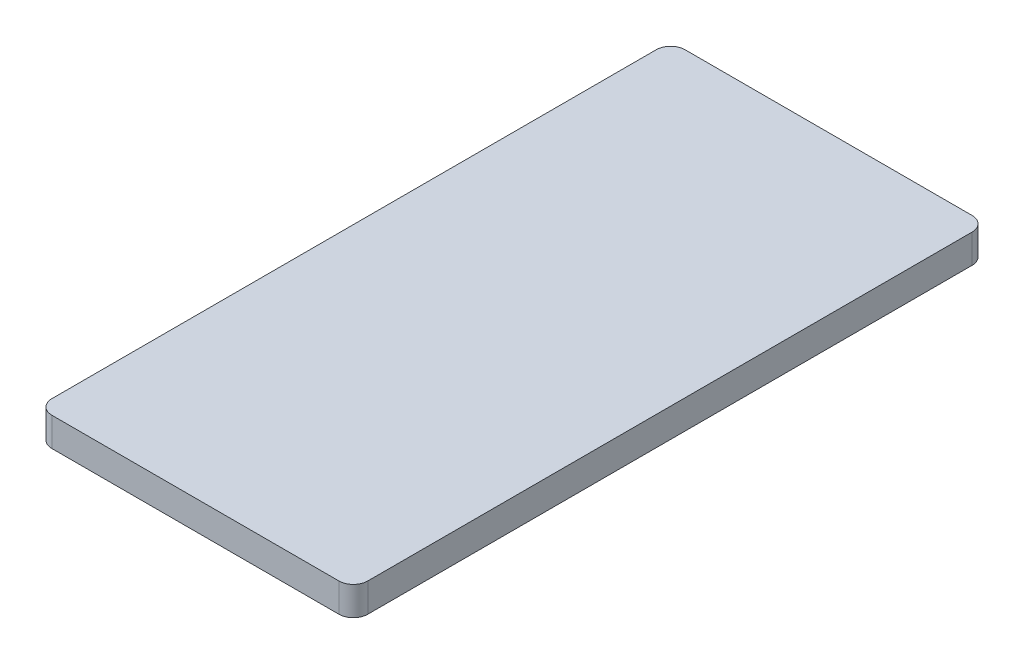
from build123d import *

# Parameters (mm, degrees)
BOSS_EXTRUDE1_DEPTH = 2.54


with BuildPart() as part:
    # Sketch1 → Boss-Extrude1 (new body)
    with BuildSketch(Plane(origin=(0, 0, 0), x_dir=(1, 0, 0), z_dir=(0, 1, 0))):
        with BuildLine():
            Line((-12.6365, -27.8765), (12.6365, -27.8765))
            ThreePointArc((12.6365, -27.8765), (13.534525612, -27.504525612), (13.9065, -26.6065))
            Line((13.9065, -26.6065), (13.9065, 26.6065))
            ThreePointArc((13.9065, 26.6065), (13.534525612, 27.504525612), (12.6365, 27.8765))
            Line((12.6365, 27.8765), (-12.6365, 27.8765))
            ThreePointArc((-12.6365, 27.8765), (-13.534525612, 27.504525612), (-13.9065, 26.6065))
            Line((-13.9065, 26.6065), (-13.9065, -26.6065))
            ThreePointArc((-13.9065, -26.6065), (-13.534525612, -27.504525612), (-12.6365, -27.8765))
        make_face()
    extrude(amount=BOSS_EXTRUDE1_DEPTH)


solid = part.part
